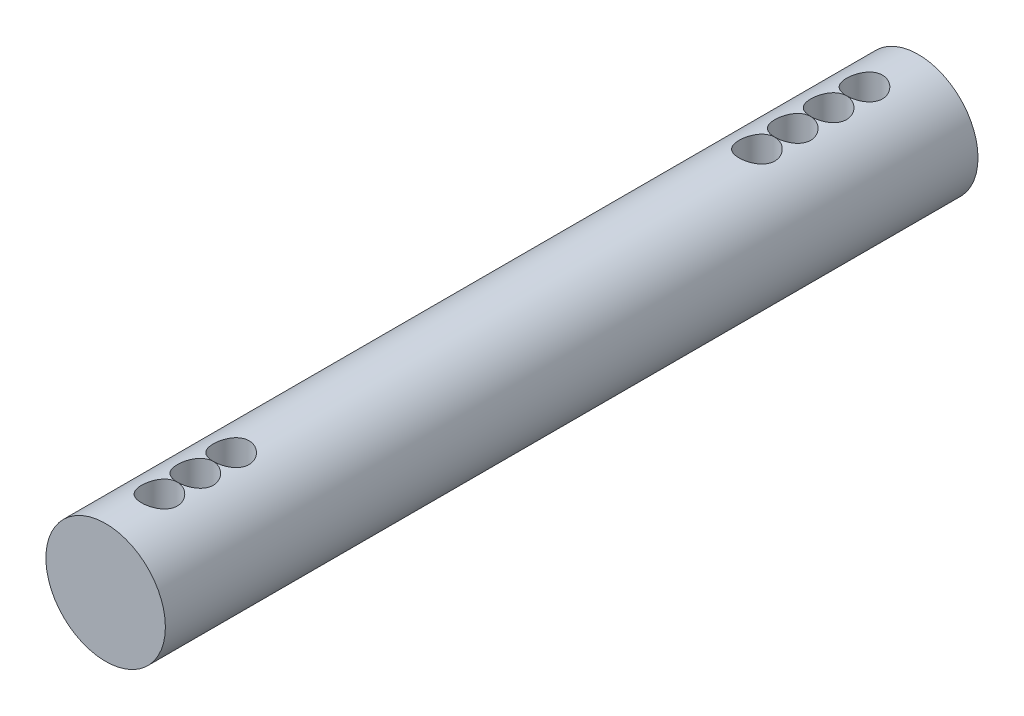
from build123d import *

# Parameters (mm, degrees)
SKETCH1_R           = 5
BOSS_EXTRUDE1_DEPTH = 34
CUT_EXTRUDE1_START  = -35.727510708
SKETCH2_R           = 1.5
CUT_EXTRUDE1_DEPTH  = 66.455021417
LPATTERN3_COUNT     = 3
LPATTERN3_PITCH     = 3.001
CUT_EXTRUDE2_START  = -35.727510835
SKETCH3_R           = 1.5
CUT_EXTRUDE2_DEPTH  = 66.45502167
LPATTERN4_COUNT     = 4
LPATTERN4_PITCH     = 3.001


with BuildPart() as part:
    # Sketch1 → Boss-Extrude1 (new, symmetric)
    with BuildSketch(Plane.XY):
        Circle(SKETCH1_R)
    extrude(amount=BOSS_EXTRUDE1_DEPTH, both=True)

    # Sketch2 → Cut-Extrude1 (cut)
    with BuildSketch(Plane(origin=(0, 0, 0), x_dir=(1, 0, 0), z_dir=(0, 1, 0)).offset(CUT_EXTRUDE1_START)):
        with Locations(Location((0, -29.5, 0), (0, 0, 270))):
            Circle(SKETCH2_R)
    cut_extrude1 = extrude(amount=CUT_EXTRUDE1_DEPTH, mode=Mode.SUBTRACT)

    # LPattern3: Cut-Extrude1 ×3
    with Locations(*[(0, 0, -i * LPATTERN3_PITCH) for i in range(1, LPATTERN3_COUNT)]):
        add(cut_extrude1, mode=Mode.SUBTRACT)

    # Sketch3 → Cut-Extrude2 (cut)
    with BuildSketch(Plane(origin=(0, 0, 0), x_dir=(1, 0, 0), z_dir=(0, 1, 0)).offset(CUT_EXTRUDE2_START)):
        with Locations(Location((0, 29.5, 0), (0, 0, 270))):
            Circle(SKETCH3_R)
    cut_extrude2 = extrude(amount=CUT_EXTRUDE2_DEPTH, mode=Mode.SUBTRACT)

    # LPattern4: Cut-Extrude2 ×4
    with Locations(*[(0, 0, i * LPATTERN4_PITCH) for i in range(1, LPATTERN4_COUNT)]):
        add(cut_extrude2, mode=Mode.SUBTRACT)


solid = part.part
